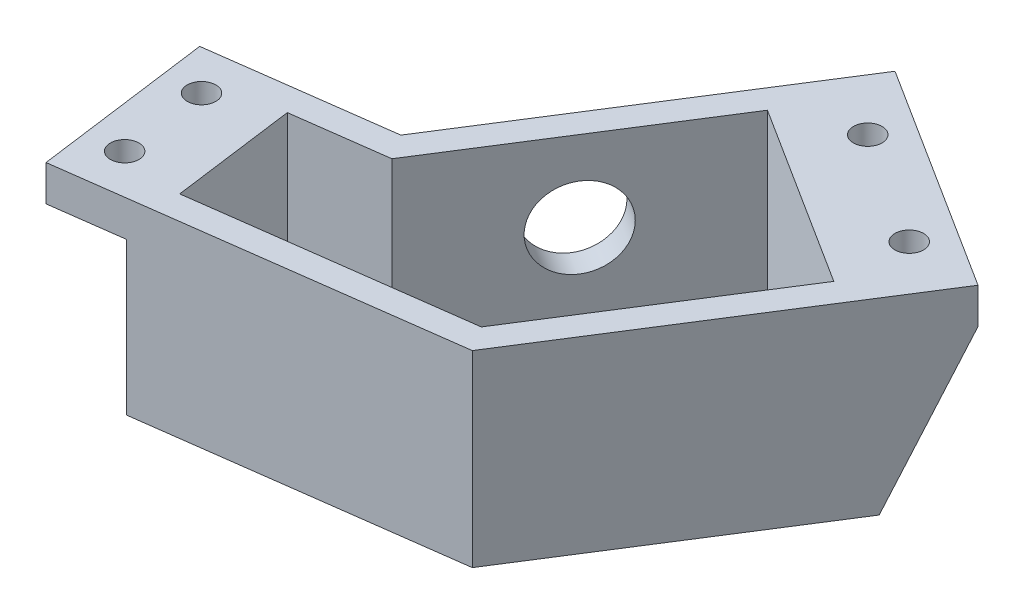
from build123d import *

# Parameters (mm, degrees)
BOSS_EXTRUDE1_DEPTH = 21
CUT_EXTRUDE1_START  = -21
CUT_EXTRUDE1_DEPTH  = 17
CUT_EXTRUDE2_DEPTH  = 18
SKETCH4_R           = 4.5
CUT_EXTRUDE3_DEPTH  = 61.406520735
SKETCH5_R           = 1.6
CUT_EXTRUDE4_DEPTH  = 61.135869745
CUT_EXTRUDE5_DEPTH  = 0.5
SKETCH7_R           = 3
CUT_EXTRUDE6_DEPTH  = 70.022736907
BOSS_EXTRUDE2_DEPTH = 30
SKETCH9_R           = 1.6
CUT_EXTRUDE7_DEPTH  = 62.386666638
CUT_EXTRUDE8_START  = -4
SKETCH10_R          = 3.5
CUT_EXTRUDE8_DEPTH  = 58.386666638
CUT_EXTRUDE9_DEPTH  = 0.5


with BuildPart() as part:
    # Sketch1 → Boss-Extrude1 (new body)
    with BuildSketch(Plane(origin=(0, 0, 0), x_dir=(1, 0, 0), z_dir=(0, 1, 0))):
        Polygon((0, 0), (-19.823417158, -2.651816769), (-17.171600389, -22.475233927), (24.834444629, -16.856004221), (46.756935141, 17.714090893), (21.421674862, 33.78034704), align=None)
    extrude(amount=BOSS_EXTRUDE1_DEPTH)

    # Sketch2 → Cut-Extrude1 (cut)
    with BuildSketch(Plane(origin=(0, 21, 0), x_dir=(1, 0, 0), z_dir=(0, 1, 0)).offset(CUT_EXTRUDE1_START)):
        Polygon((21.421674862, 33.78034704), (17.137339889, 27.024277632), (42.472600169, 10.958021485), (46.756935141, 17.714090893), align=None)
        Polygon((-19.823417158, -2.651816769), (-17.171600389, -22.475233927), (-9.242233526, -21.414507219), (-11.894050295, -1.591090061), align=None)
    extrude(amount=CUT_EXTRUDE1_DEPTH, mode=Mode.SUBTRACT)

    # Sketch3 → Cut-Extrude2 (cut)
    with BuildSketch(Plane(origin=(0, 21, 0), x_dir=(1, 0, 0), z_dir=(0, 1, 0))):
        Polygon((23.050100429, -14.067976017), (38.332448526, 10.031121072), (18.064240303, 22.884125989), (1.7843442, -2.788028204), (-8.522765206, -4.16683012), (-6.666493468, -18.04322213), align=None)
    extrude(amount=-CUT_EXTRUDE2_DEPTH, mode=Mode.SUBTRACT)

    # Sketch4 → Cut-Extrude3 (cut, through all)
    with BuildSketch(Plane(origin=(2.533526028, 0, 1.606625615), x_dir=(0.53554187154216, 0, -0.8445086759916209), z_dir=(0.8445086759916209, 0, 0.53554187154216))):
        with Locations((13.800538513, 12)):
            Circle(SKETCH4_R)
    extrude(amount=-CUT_EXTRUDE3_DEPTH, mode=Mode.SUBTRACT)

    # Sketch5 → Cut-Extrude4 (cut, through all)
    with BuildSketch(Plane(origin=(0, 17, 0), x_dir=(-1, 0, 0), z_dir=(0, -1, 0))):
        with Locations(Location((-38.703206923, 18.08484929, 0), (0, 0, 90))):
            Circle(SKETCH5_R)
        with Locations(Location((-26.035576783, 26.117977363, 0), (0, 0, 90))):
            Circle(SKETCH5_R)
        with Locations(Location((13.86987115, -16.989016284, 0), (0, 0, 90))):
            Circle(SKETCH5_R)
        with Locations(Location((15.195779534, -7.077307705, 0), (0, 0, 90))):
            Circle(SKETCH5_R)
    extrude(amount=-CUT_EXTRUDE4_DEPTH, mode=Mode.SUBTRACT)

    # Sketch6 → Cut-Extrude5 (cut)
    # profile 1 of 3: a face of its own
    with BuildSketch(Plane(origin=(0, 0, 0), x_dir=(-0.535541871542157, 0, 0.8445086759916229), z_dir=(-0.8445086759916228, 0, -0.5355418715421569))):
        with BuildLine():
            add(Edge.make_bspline(
                [(-25.481971154, 7.115384615), (-25.519043916, 7.115596913), (-25.591850035, 7.116013838), (-25.698659344, 7.123238188), (-25.801040056, 7.132760442), (-25.898589468, 7.148267419), (-25.991764145, 7.166509285), (-26.08053643, 7.189325018), (-26.164595001, 7.216809897), (-26.21826549, 7.238674335), (-26.244591346, 7.249399038)],
                knots=[0, 0, 0, 0, 1.141009212, 2.240794809, 3.294380675, 4.305229195, 5.280013876, 6.216333343, 7.125095522, 8, 8, 8, 8], degree=3))
            add(Edge.make_bspline(
                [(-26.244591346, 7.249399038), (-26.282022531, 7.266921517), (-26.356444649, 7.30176038), (-26.46164204, 7.366700849), (-26.561260022, 7.439709664), (-26.653992687, 7.521111837), (-26.738136642, 7.60885611), (-26.810721137, 7.702353369), (-26.873462326, 7.799148703), (-26.905037843, 7.867966696), (-26.920673077, 7.902043269)],
                knots=[0, 0, 0, 0, 1.031298788, 2.050467816, 3.080965632, 4.112446372, 5.127889083, 6.11150152, 7.064873096, 8, 8, 8, 8], degree=3))
            add(Edge.make_bspline(
                [(-26.920673077, 7.902043269), (-26.93016146, 7.925175642), (-26.949339902, 7.971932066), (-26.973275602, 8.044597051), (-26.992722276, 8.120019152), (-27.010105338, 8.197652845), (-27.02209153, 8.278251888), (-27.032141541, 8.361165007), (-27.037408926, 8.446845958), (-27.038106852, 8.504801639), (-27.038461538, 8.534254808)],
                knots=[0, 0, 0, 0, 0.92659354, 1.872881803, 2.832850937, 3.813025581, 4.820167273, 5.851730198, 6.908245912, 8, 8, 8, 8], degree=3))
            add(Edge.make_bspline(
                [(-27.038461538, 8.534254808), (-27.037139566, 8.586992987), (-27.034552446, 8.690202327), (-27.015865991, 8.840962191), (-26.984312193, 8.983626799), (-26.938705253, 9.117713214), (-26.881695607, 9.244377546), (-26.810981567, 9.362635477), (-26.727328774, 9.472662819), (-26.631883246, 9.574244079), (-26.52481561, 9.665734035), (-26.407109844, 9.745381324), (-26.279214048, 9.812405384), (-26.141566535, 9.867022734), (-25.994036794, 9.90970595), (-25.836773836, 9.940110624), (-25.669500043, 9.958298508), (-25.55473409, 9.960439106), (-25.495793269, 9.961538462)],
                knots=[0, 0, 0, 0, 1.064649597, 2.083533894, 3.06182455, 4.009573214, 4.938114978, 5.86134754, 6.785138072, 7.723633163, 8.670337, 9.622734556, 10.587021061, 11.579917593, 12.607721694, 13.68331646, 14.81021135, 16, 16, 16, 16], degree=3))
            add(Edge.make_bspline(
                [(-25.495793269, 9.961538462), (-25.437248653, 9.960459716), (-25.323273224, 9.958359599), (-25.157290956, 9.939899601), (-25.000872201, 9.910453418), (-24.854535562, 9.867519594), (-24.717432428, 9.813692828), (-24.59087976, 9.746358425), (-24.473111052, 9.668326572), (-24.367191854, 9.576980639), (-24.271199977, 9.477105356), (-24.188524506, 9.367218557), (-24.11771475, 9.249821226), (-24.060540329, 9.123847562), (-24.015872655, 8.990118429), (-23.984076387, 8.848197467), (-23.965461841, 8.698011874), (-23.962865328, 8.595204669), (-23.961538462, 8.542668269)],
                knots=[0, 0, 0, 0, 1.188441339, 2.313673251, 3.386638619, 4.416397407, 5.405891428, 6.372077474, 7.321986495, 8.268353052, 9.206290124, 10.129648818, 11.054654577, 11.984788619, 12.932788448, 13.912688147, 14.933344701, 16, 16, 16, 16], degree=3))
            add(Edge.make_bspline(
                [(-23.961538462, 8.542668269), (-23.96287496, 8.489534093), (-23.96549087, 8.385535247), (-23.983956803, 8.233715211), (-24.016077926, 8.090562948), (-24.059731702, 7.955358099), (-24.117158894, 7.828681905), (-24.18699078, 7.710170245), (-24.270268758, 7.600637638), (-24.365109898, 7.499920583), (-24.470720887, 7.408626594), (-24.587740712, 7.330731306), (-24.713182887, 7.263204503), (-24.848945004, 7.209523441), (-24.993630944, 7.166442149), (-25.148073045, 7.13707836), (-25.311846297, 7.11854913), (-25.424226352, 7.116458734), (-25.481971154, 7.115384615)],
                knots=[0, 0, 0, 0, 1.080851458, 2.115536814, 3.105208919, 4.06142606, 5.000707585, 5.928846123, 6.853919921, 7.79375822, 8.738786042, 9.687076824, 10.64785939, 11.631623957, 12.651566366, 13.714523363, 14.825642194, 16, 16, 16, 16], degree=3))
        make_face()
        with BuildLine():
            add(Edge.make_bspline(
                [(-25.501802885, 7.692307692), (-25.460305005, 7.692884104), (-25.379945152, 7.694000313), (-25.263304007, 7.705886948), (-25.15426369, 7.72393079), (-25.052935329, 7.75045007), (-24.959289256, 7.784007824), (-24.873248867, 7.824857285), (-24.795047204, 7.873695174), (-24.725479679, 7.930495525), (-24.663560037, 7.992556719), (-24.608912846, 8.05854265), (-24.563732685, 8.129669452), (-24.526158513, 8.204273746), (-24.497433905, 8.283017239), (-24.47587085, 8.365406556), (-24.464094422, 8.452181912), (-24.462399587, 8.511385625), (-24.461538462, 8.541466346)],
                knots=[0, 0, 0, 0, 1.313714757, 2.543983635, 3.708927593, 4.810629344, 5.856122632, 6.85490097, 7.821198974, 8.76835797, 9.692418868, 10.594039946, 11.475666139, 12.355144307, 13.23425633, 14.12512326, 15.047396847, 16, 16, 16, 16], degree=3))
            add(Edge.make_bspline(
                [(-24.461538462, 8.541466346), (-24.462381853, 8.571551327), (-24.464041785, 8.630763423), (-24.476063951, 8.71742922), (-24.496689599, 8.799992659), (-24.525327172, 8.878385659), (-24.56329596, 8.9521992), (-24.608326757, 9.022439834), (-24.662372551, 9.087937264), (-24.72353675, 9.149659026), (-24.793497027, 9.204972301), (-24.871707942, 9.253381389), (-24.958264163, 9.294213884), (-25.052873821, 9.327774586), (-25.155703597, 9.353641083), (-25.266766587, 9.370948631), (-25.385757227, 9.382931391), (-25.467916667, 9.384043049), (-25.510216346, 9.384615385)],
                knots=[0, 0, 0, 0, 0.949303347, 1.86838219, 2.75460872, 3.63067551, 4.495816858, 5.369073575, 6.258675874, 7.17059545, 8.106564835, 9.066168793, 10.067192861, 11.120964654, 12.229518689, 13.408091079, 14.665559114, 16, 16, 16, 16], degree=3))
            add(Edge.make_bspline(
                [(-25.510216346, 9.384615385), (-25.552108013, 9.383969942), (-25.633235205, 9.382719981), (-25.750718105, 9.371805654), (-25.860039827, 9.353994527), (-25.961257299, 9.328979376), (-26.054356133, 9.296661883), (-26.13918442, 9.256804777), (-26.216042602, 9.209976136), (-26.284279177, 9.155636959), (-26.34365973, 9.095137302), (-26.39620725, 9.030483666), (-26.439866377, 8.960430907), (-26.476636554, 8.885966453), (-26.503907129, 8.806263231), (-26.523800526, 8.722145203), (-26.536050303, 8.633370457), (-26.537645871, 8.572555469), (-26.538461538, 8.541466346)],
                knots=[0, 0, 0, 0, 1.332239421, 2.580008232, 3.749024652, 4.852419255, 5.89224124, 6.878439556, 7.828083302, 8.748549668, 9.645153656, 10.519845698, 11.393144178, 12.26513999, 13.155815239, 14.066102797, 15.011375811, 16, 16, 16, 16], degree=3))
            add(Edge.make_bspline(
                [(-26.538461538, 8.541466346), (-26.537658138, 8.510373467), (-26.536086566, 8.449551131), (-26.523637899, 8.360635575), (-26.504323064, 8.276261332), (-26.475546227, 8.196537779), (-26.43898766, 8.121637931), (-26.394639124, 8.050979228), (-26.342076194, 7.985212144), (-26.281245693, 7.924513221), (-26.212475961, 7.86933815), (-26.13486413, 7.821751531), (-26.049083449, 7.781665005), (-25.955377314, 7.748323554), (-25.853338935, 7.723779715), (-25.743580555, 7.704877595), (-25.625409401, 7.694271803), (-25.543890602, 7.692976467), (-25.501802885, 7.692307692)],
                knots=[0, 0, 0, 0, 0.981853791, 1.920653289, 2.83086505, 3.71158433, 4.591757822, 5.459075689, 6.341611823, 7.24548826, 8.168543921, 9.120390574, 10.113981418, 11.154755163, 12.256733604, 13.425033512, 14.670558662, 16, 16, 16, 16], degree=3))
        make_face(mode=Mode.SUBTRACT)
    # profile 2 of 3: a face of its own
    with BuildSketch(Plane(origin=(0, 0, 0), x_dir=(-0.535541871542157, 0, 0.8445086759916229), z_dir=(-0.8445086759916228, 0, -0.5355418715421569))):
        with BuildLine():
            Line((-27, 10.461538462), (-27, 11.670072115))
            add(Edge.make_bspline(
                [(-27, 11.670072115), (-26.999829839, 11.69911853), (-26.999501238, 11.755210481), (-26.998535392, 11.836555857), (-26.995925878, 11.912071726), (-26.993177143, 11.981811766), (-26.989015594, 12.045739573), (-26.983529546, 12.104024953), (-26.977571556, 12.156724301), (-26.969251475, 12.219066699), (-26.952901236, 12.291037471), (-26.9257717, 12.372788016), (-26.891019068, 12.449903718), (-26.847978488, 12.522166934), (-26.796622607, 12.588989047), (-26.737734627, 12.650454797), (-26.670619287, 12.705664861), (-26.596700626, 12.754505577), (-26.516468682, 12.796189734), (-26.429963025, 12.824477121), (-26.339112286, 12.842837434), (-26.276934736, 12.845032988), (-26.245192308, 12.846153846)],
                knots=[0, 0, 0, 0, 1.096429411, 2.11733074, 3.070547401, 3.948484499, 4.751738927, 5.488345268, 6.158031143, 6.753656584, 7.861679414, 8.937685829, 10.000271379, 11.048064588, 12.105201638, 13.174759257, 14.254240477, 15.378323745, 16.514548679, 17.655117985, 18.802907975, 20, 20, 20, 20], degree=3))
            add(Edge.make_bspline(
                [(-26.245192308, 12.846153846), (-26.210634021, 12.8449602), (-26.142296386, 12.842599811), (-26.042271297, 12.821429805), (-25.946775819, 12.786857951), (-25.857164728, 12.738764435), (-25.774814303, 12.679613112), (-25.702491281, 12.609682354), (-25.64064846, 12.52996076), (-25.609874918, 12.470100717), (-25.594350962, 12.439903846)],
                knots=[0, 0, 0, 0, 1.023035585, 2.023012119, 3.014443124, 4.023521462, 5.026822086, 6.009113309, 6.995681492, 8, 8, 8, 8], degree=3))
            add(Edge.make_bspline(
                [(-25.594350962, 12.439903846), (-25.587423552, 12.460242094), (-25.573726282, 12.500456043), (-25.548574178, 12.558016123), (-25.519405368, 12.611946801), (-25.487139642, 12.662220995), (-25.451541125, 12.70922027), (-25.411429455, 12.751571491), (-25.369086696, 12.791704794), (-25.322387367, 12.826938721), (-25.273565026, 12.858830833), (-25.221855502, 12.885902469), (-25.168502544, 12.909344251), (-25.112966185, 12.928949048), (-25.054873943, 12.942923846), (-24.99495763, 12.954121325), (-24.932801987, 12.959849642), (-24.890834532, 12.9609709), (-24.869591346, 12.961538462)],
                knots=[0, 0, 0, 0, 1.072651974, 2.1209089, 3.132484228, 4.131466326, 5.101889999, 6.071643115, 7.041396231, 8.011819904, 8.988565287, 9.95070344, 10.922775742, 11.897213062, 12.887138018, 13.903598663, 14.938838629, 16, 16, 16, 16], degree=3))
            add(Edge.make_bspline(
                [(-24.869591346, 12.961538462), (-24.835671396, 12.960311701), (-24.767790691, 12.957856703), (-24.666748173, 12.940109913), (-24.567633839, 12.909383527), (-24.471010207, 12.868369976), (-24.379748234, 12.817223182), (-24.296473419, 12.757074763), (-24.223913636, 12.687154304), (-24.160687585, 12.609092815), (-24.107892265, 12.52164272), (-24.066406937, 12.42460252), (-24.035929576, 12.317962396), (-24.025702385, 12.242968499), (-24.020432692, 12.204326923)],
                knots=[0, 0, 0, 0, 0.975156922, 1.951486961, 2.939068488, 3.953317763, 4.964290502, 5.941282984, 6.898653353, 7.853108183, 8.82218994, 9.825850537, 10.879741348, 12, 12, 12, 12], degree=3))
            add(Edge.make_bspline(
                [(-24.020432692, 12.204326923), (-24.019182549, 12.189506964), (-24.016312748, 12.155486609), (-24.012744807, 12.097789978), (-24.01004784, 12.026849109), (-24.006859019, 11.942725601), (-24.004556596, 11.845160485), (-24.002984353, 11.734375498), (-24.000943891, 11.610181612), (-24.000325522, 11.523037731), (-24, 11.477163462)],
                knots=[0, 0, 0, 0, 0.490565993, 1.126131979, 1.906526787, 2.832178623, 3.902933831, 5.125497984, 6.486805064, 8, 8, 8, 8], degree=3))
            Line((-24, 11.477163462), (-24, 10.461538462))
            Line((-24, 10.461538462), (-27, 10.461538462))
        make_face()
        with BuildLine():
            Line((-26.5, 11.038461538), (-25.807692308, 11.038461538))
            Line((-25.807692308, 11.038461538), (-25.807692308, 11.456129808))
            add(Edge.make_bspline(
                [(-25.807692308, 11.456129808), (-25.807627432, 11.485577184), (-25.807503857, 11.541668178), (-25.808331952, 11.621394012), (-25.808718542, 11.692512494), (-25.809853128, 11.754819157), (-25.811725614, 11.808301209), (-25.813595444, 11.852765946), (-25.815011121, 11.888470314), (-25.817032644, 11.909260138), (-25.817908654, 11.918269231)],
                knots=[0, 0, 0, 0, 1.528479216, 2.911428072, 4.138414629, 5.21998762, 6.145918986, 6.915989543, 7.530253335, 8, 8, 8, 8], degree=3))
            add(Edge.make_bspline(
                [(-25.817908654, 11.918269231), (-25.821813578, 11.94425394), (-25.829318601, 11.994194958), (-25.851396789, 12.064017413), (-25.883089948, 12.124910352), (-25.923469926, 12.176260658), (-25.971463519, 12.218177521), (-26.027440739, 12.248220531), (-26.090883983, 12.265997132), (-26.135500314, 12.268125999), (-26.158653846, 12.269230769)],
                knots=[0, 0, 0, 0, 1.162264213, 2.233800515, 3.225686071, 4.185688492, 5.110247391, 6.026987019, 6.97610994, 8, 8, 8, 8], degree=3))
            add(Edge.make_bspline(
                [(-26.158653846, 12.269230769), (-26.180793978, 12.268483905), (-26.223675901, 12.267037349), (-26.284413111, 12.25090452), (-26.338820717, 12.225279845), (-26.386270412, 12.189433333), (-26.425988199, 12.143393663), (-26.457048073, 12.087429902), (-26.478389208, 12.021428282), (-26.485858168, 11.973898604), (-26.489783654, 11.948918269)],
                knots=[0, 0, 0, 0, 1.035049891, 2.004727485, 2.919825608, 3.837662617, 4.769073254, 5.748061413, 6.816440993, 8, 8, 8, 8], degree=3))
            add(Edge.make_bspline(
                [(-26.489783654, 11.948918269), (-26.490662317, 11.939107556), (-26.492739634, 11.915913271), (-26.494090042, 11.875601318), (-26.495990652, 11.824326887), (-26.497845551, 11.76182862), (-26.49897807, 11.688104826), (-26.499359767, 11.603365178), (-26.500191478, 11.507613461), (-26.50006618, 11.440104392), (-26.5, 11.404447115)],
                knots=[0, 0, 0, 0, 0.433943041, 1.02591908, 1.776648879, 2.694999143, 3.780816848, 5.02540149, 6.428861738, 8, 8, 8, 8], degree=3))
            Line((-26.5, 11.404447115), (-26.5, 11.038461538))
        make_face(mode=Mode.SUBTRACT)
        with BuildLine():
            Line((-25.307692308, 11.038461538), (-24.5, 11.038461538))
            Line((-24.5, 11.038461538), (-24.5, 11.627403846))
            add(Edge.make_bspline(
                [(-24.5, 11.627403846), (-24.499863857, 11.654849116), (-24.499605468, 11.706938288), (-24.501336126, 11.781246776), (-24.501906787, 11.847581993), (-24.504753848, 11.906254416), (-24.50690762, 11.956955733), (-24.509592659, 11.999894565), (-24.513862645, 12.034735646), (-24.51717765, 12.05529621), (-24.518629808, 12.064302885)],
                knots=[0, 0, 0, 0, 1.504773752, 2.85595359, 4.075347731, 5.141676974, 6.076328919, 6.858106537, 7.499786952, 8, 8, 8, 8], degree=3))
            add(Edge.make_bspline(
                [(-24.518629808, 12.064302885), (-24.523452405, 12.087178484), (-24.532822335, 12.13162399), (-24.559773701, 12.193170956), (-24.593797601, 12.248964005), (-24.638292973, 12.296380897), (-24.690270747, 12.336528197), (-24.751612293, 12.364803398), (-24.820975488, 12.382065586), (-24.869884469, 12.383740482), (-24.895432692, 12.384615385)],
                knots=[0, 0, 0, 0, 1.031197338, 2.003536075, 2.954663529, 3.907439386, 4.862312829, 5.841045557, 6.872242896, 8, 8, 8, 8], degree=3))
            add(Edge.make_bspline(
                [(-24.895432692, 12.384615385), (-24.917342072, 12.383913278), (-24.959986122, 12.382546708), (-25.021207783, 12.368890135), (-25.07733066, 12.347275825), (-25.127679698, 12.316874591), (-25.172373142, 12.278437721), (-25.210244593, 12.231657862), (-25.241791864, 12.177334022), (-25.262468122, 12.125566298), (-25.276075055, 12.076571196), (-25.283604856, 12.029555558), (-25.291917313, 11.973351478), (-25.297248129, 11.907504569), (-25.302368477, 11.83219625), (-25.30473926, 11.747401334), (-25.307642868, 11.653063648), (-25.307675305, 11.586942231), (-25.307692308, 11.552283654)],
                knots=[0, 0, 0, 0, 0.992106207, 1.931018896, 2.828370935, 3.708502536, 4.584358549, 5.488032304, 6.424305121, 7.422835477, 8.006778734, 8.726588553, 9.579537412, 10.582807491, 11.720527972, 13.002061418, 14.42858352, 16, 16, 16, 16], degree=3))
            Line((-25.307692308, 11.552283654), (-25.307692308, 11.038461538))
        make_face(mode=Mode.SUBTRACT)
    # profile 3 of 3: a face of its own
    with BuildSketch(Plane(origin=(0, 0, 0), x_dir=(-0.535541871542157, 0, 0.8445086759916229), z_dir=(-0.8445086759916228, 0, -0.5355418715421569))):
        with BuildLine():
            Line((-25, 13.307692308), (-25.038461538, 13.884615385))
            add(Edge.make_bspline(
                [(-25.038461538, 13.884615385), (-25.014325164, 13.889211635), (-24.967441791, 13.898139559), (-24.900625678, 13.917974513), (-24.838337454, 13.939811572), (-24.781229878, 13.965892906), (-24.728300518, 13.994496986), (-24.680996633, 14.027653327), (-24.638323004, 14.063906613), (-24.600923427, 14.104032127), (-24.567375533, 14.147390526), (-24.539477399, 14.195160587), (-24.515191817, 14.245962321), (-24.495244421, 14.300227052), (-24.480340314, 14.358458017), (-24.469740566, 14.420163608), (-24.462951817, 14.485427865), (-24.462017292, 14.530030966), (-24.461538462, 14.552884615)],
                knots=[0, 0, 0, 0, 1.204677245, 2.340008924, 3.41562088, 4.44046575, 5.417001248, 6.3630415, 7.269134822, 8.159094629, 9.049542694, 9.952967105, 10.867337362, 11.809438639, 12.784390299, 13.812011701, 14.878922867, 16, 16, 16, 16], degree=3))
            add(Edge.make_bspline(
                [(-24.461538462, 14.552884615), (-24.461803029, 14.576938793), (-24.462317625, 14.623725407), (-24.468621119, 14.691536222), (-24.477793927, 14.754899336), (-24.491826379, 14.813506878), (-24.50906377, 14.867651171), (-24.529965003, 14.917385594), (-24.555430102, 14.962331503), (-24.584826815, 15.002363925), (-24.616681388, 15.037535628), (-24.649420548, 15.068740738), (-24.683400036, 15.095358936), (-24.719540045, 15.116512933), (-24.756444873, 15.133598287), (-24.795168749, 15.144898175), (-24.834834519, 15.152529884), (-24.861942939, 15.153405163), (-24.875600962, 15.153846154)],
                knots=[0, 0, 0, 0, 1.418030258, 2.758141892, 4.012849053, 5.190504034, 6.307525772, 7.360759663, 8.365925826, 9.346494891, 10.283396317, 11.160841652, 12.011476082, 12.821866951, 13.625513811, 14.402856512, 15.195311921, 16, 16, 16, 16], degree=3))
            add(Edge.make_bspline(
                [(-24.875600962, 15.153846154), (-24.892711707, 15.153302782), (-24.926186378, 15.152239756), (-24.974070585, 15.13953899), (-25.018475972, 15.120239824), (-25.059089598, 15.091851304), (-25.095895755, 15.053130474), (-25.129496324, 15.003464578), (-25.160546832, 14.942361306), (-25.177745659, 14.896828922), (-25.186899038, 14.872596154)],
                knots=[0, 0, 0, 0, 0.904653283, 1.769821757, 2.60630992, 3.46039906, 4.376381456, 5.421829955, 6.627873392, 8, 8, 8, 8], degree=3))
            add(Edge.make_bspline(
                [(-25.186899038, 14.872596154), (-25.190381689, 14.862203428), (-25.198175294, 14.838946197), (-25.209319416, 14.799271829), (-25.223235462, 14.751482998), (-25.23905327, 14.694889127), (-25.255230724, 14.629509244), (-25.275159512, 14.556073557), (-25.294990285, 14.473686804), (-25.309629357, 14.416048933), (-25.317307692, 14.385817308)],
                knots=[0, 0, 0, 0, 0.521821638, 1.167752076, 1.961721917, 2.891982557, 3.96540661, 5.168436773, 6.514817513, 8, 8, 8, 8], degree=3))
            add(Edge.make_bspline(
                [(-25.317307692, 14.385817308), (-25.327145249, 14.346449908), (-25.346125207, 14.270496949), (-25.379760539, 14.162119818), (-25.413605954, 14.06255486), (-25.448821325, 13.971806856), (-25.486655952, 13.890540118), (-25.526165732, 13.818455644), (-25.566851751, 13.754929311), (-25.597210812, 13.717892565), (-25.611778846, 13.700120192)],
                knots=[0, 0, 0, 0, 1.293827876, 2.496229314, 3.617486305, 4.647214227, 5.598941135, 6.473853732, 7.267666729, 8, 8, 8, 8], degree=3))
            add(Edge.make_bspline(
                [(-25.611778846, 13.700120192), (-25.632413082, 13.67808203), (-25.672868411, 13.634874176), (-25.739344279, 13.577997742), (-25.809565398, 13.53020605), (-25.883013443, 13.490868255), (-25.960111249, 13.460578897), (-26.040342757, 13.43911019), (-26.123917363, 13.425214862), (-26.180833649, 13.42379694), (-26.209735577, 13.423076923)],
                knots=[0, 0, 0, 0, 1.064429417, 2.086912298, 3.078678339, 4.055528992, 5.020032834, 5.993708893, 6.981211098, 8, 8, 8, 8], degree=3))
            add(Edge.make_bspline(
                [(-26.209735577, 13.423076923), (-26.246925124, 13.424519292), (-26.321090592, 13.427395744), (-26.430054541, 13.452513629), (-26.535233017, 13.492843444), (-26.619021693, 13.538438413), (-26.682339616, 13.582879064), (-26.727701632, 13.619635967), (-26.770148503, 13.660034047), (-26.808654955, 13.704606519), (-26.845473756, 13.751703691), (-26.878169438, 13.803148803), (-26.908966919, 13.857483631), (-26.945475915, 13.936112283), (-26.98352187, 14.042868429), (-27.015592197, 14.181763905), (-27.034870606, 14.332993576), (-27.037235659, 14.437841572), (-27.038461538, 14.4921875)],
                knots=[0, 0, 0, 0, 1.173854899, 2.340966893, 3.512960251, 4.725330002, 5.343426374, 5.955334136, 6.568647945, 7.192068799, 7.814943173, 8.455761621, 9.116040544, 9.787122478, 11.192596942, 12.687979905, 14.283278534, 16, 16, 16, 16], degree=3))
            add(Edge.make_bspline(
                [(-27.038461538, 14.4921875), (-27.037866482, 14.536685992), (-27.03670911, 14.623234607), (-27.02500558, 14.748696879), (-27.00679042, 14.865885448), (-26.980642643, 14.974389085), (-26.946094565, 15.074258347), (-26.904941273, 15.165880355), (-26.856081989, 15.249177252), (-26.799236327, 15.323134983), (-26.73656763, 15.389024231), (-26.668115224, 15.446502063), (-26.594743622, 15.495788228), (-26.516506443, 15.537200812), (-26.433001434, 15.569722005), (-26.344332791, 15.593607537), (-26.25070922, 15.609405635), (-26.186557414, 15.613365477), (-26.153846154, 15.615384615)],
                knots=[0, 0, 0, 0, 1.325124071, 2.577337985, 3.749592149, 4.855247722, 5.896868755, 6.892903601, 7.842551483, 8.766257401, 9.665194363, 10.546067736, 11.423174165, 12.293291263, 13.177512979, 14.086532529, 15.024315359, 16, 16, 16, 16], degree=3))
            Line((-26.153846154, 15.615384615), (-26.115384615, 15.038461538))
            add(Edge.make_bspline(
                [(-26.115384615, 15.038461538), (-26.133475993, 15.035134463), (-26.168734206, 15.028650339), (-26.21922089, 15.014533168), (-26.26595287, 14.998676409), (-26.308920446, 14.979816624), (-26.347619236, 14.957899828), (-26.382273217, 14.932873778), (-26.413286287, 14.905712246), (-26.440609282, 14.875652551), (-26.463671321, 14.841607239), (-26.484214353, 14.804559038), (-26.500964324, 14.763111717), (-26.514763926, 14.717853088), (-26.525353743, 14.668582237), (-26.533309298, 14.615610612), (-26.537170598, 14.558750241), (-26.538021374, 14.519635678), (-26.538461538, 14.499399038)],
                knots=[0, 0, 0, 0, 1.150855866, 2.242898388, 3.27787599, 4.237823789, 5.175651342, 6.056061848, 6.908895975, 7.75236871, 8.590605917, 9.477244771, 10.399349179, 11.382998967, 12.435674925, 13.55107929, 14.733005797, 16, 16, 16, 16], degree=3))
            add(Edge.make_bspline(
                [(-26.538461538, 14.499399038), (-26.538073505, 14.478358156), (-26.537318567, 14.437422181), (-26.532685629, 14.377767553), (-26.524133671, 14.321807036), (-26.513001143, 14.269265793), (-26.497856108, 14.220214005), (-26.479389219, 14.174755188), (-26.457648006, 14.132681364), (-26.44054277, 14.10702658), (-26.432091346, 14.094350962)],
                knots=[0, 0, 0, 0, 1.186678824, 2.308736671, 3.37120409, 4.377216403, 5.334874112, 6.262130804, 7.141346615, 8, 8, 8, 8], degree=3))
            add(Edge.make_bspline(
                [(-26.432091346, 14.094350962), (-26.420546461, 14.079844781), (-26.398187603, 14.051750811), (-26.353790513, 14.021515754), (-26.30364533, 14.00331418), (-26.268184264, 14.001123414), (-26.25, 14)],
                knots=[0, 0, 0, 0, 1.037857257, 2.010007357, 2.979541333, 4, 4, 4, 4], degree=3))
            add(Edge.make_bspline(
                [(-26.25, 14), (-26.233005598, 14.000918748), (-26.19952933, 14.002728535), (-26.151975567, 14.020982572), (-26.107913585, 14.049054794), (-26.083978539, 14.07528368), (-26.071514423, 14.088942308)],
                knots=[0, 0, 0, 0, 0.98538058, 1.941042925, 2.927803204, 4, 4, 4, 4], degree=3))
            add(Edge.make_bspline(
                [(-26.071514423, 14.088942308), (-26.063196815, 14.09976064), (-26.0446985, 14.12382055), (-26.02170651, 14.16826746), (-25.997619627, 14.222086393), (-25.973224928, 14.285982809), (-25.948122552, 14.359725444), (-25.922811589, 14.443697005), (-25.898013645, 14.537851151), (-25.872872115, 14.639341841), (-25.8484856, 14.742527168), (-25.821724378, 14.840970332), (-25.795656834, 14.932514081), (-25.768328055, 15.016726388), (-25.74172485, 15.09404313), (-25.714401211, 15.164088461), (-25.687790818, 15.227342883), (-25.651200916, 15.301106332), (-25.601630364, 15.384698564), (-25.529607844, 15.472361047), (-25.448640241, 15.549600592), (-25.372732432, 15.603960772), (-25.307143261, 15.640882787), (-25.254659976, 15.664939719), (-25.199188363, 15.68532145), (-25.141005065, 15.702293328), (-25.07999726, 15.71445386), (-25.016512561, 15.724548729), (-24.950006362, 15.729700123), (-24.904654547, 15.730409026), (-24.881610577, 15.730769231)],
                knots=[0, 0, 0, 0, 0.516255311, 1.148148894, 1.888861859, 2.751620851, 3.738268431, 4.840557414, 6.07428004, 7.42751106, 8.802854092, 10.091833706, 11.293062756, 12.409377658, 13.44651028, 14.39102378, 15.258213098, 16.045831186, 17.510454751, 18.929597364, 20.331088364, 21.740370042, 22.45410143, 23.180993031, 23.925547029, 24.691954406, 25.475059937, 26.281333581, 27.126718562, 28, 28, 28, 28], degree=3))
            add(Edge.make_bspline(
                [(-24.881610577, 15.730769231), (-24.860358778, 15.730274281), (-24.818154763, 15.72929136), (-24.75551428, 15.722418758), (-24.693982512, 15.711800473), (-24.63349976, 15.696044739), (-24.574294301, 15.675340115), (-24.515575907, 15.651547463), (-24.458247723, 15.622347233), (-24.402335753, 15.588888901), (-24.348010467, 15.552000938), (-24.297825683, 15.510255846), (-24.25036243, 15.465729393), (-24.207162838, 15.416868552), (-24.167490709, 15.364243979), (-24.130582734, 15.308548459), (-24.098245311, 15.248648092), (-24.069292847, 15.18541903), (-24.044145772, 15.118252973), (-24.021739635, 15.047317244), (-24.003408197, 14.971950186), (-23.987693997, 14.892786647), (-23.975744236, 14.809535099), (-23.967400396, 14.722300142), (-23.962695004, 14.631061799), (-23.961928766, 14.568915499), (-23.961538462, 14.537259615)],
                knots=[0, 0, 0, 0, 0.900673708, 1.788650733, 2.668102459, 3.545420189, 4.434208745, 5.325103822, 6.228854033, 7.15789738, 8.085853671, 9.00886332, 9.921780837, 10.841974279, 11.769192201, 12.713551961, 13.671065578, 14.651348434, 15.659047947, 16.709071323, 17.802583073, 18.944913937, 20.128896835, 21.365799559, 22.658199399, 24, 24, 24, 24], degree=3))
            add(Edge.make_bspline(
                [(-23.961538462, 14.537259615), (-23.962286144, 14.491553888), (-23.963741899, 14.402563754), (-23.976726822, 14.273269023), (-23.99670136, 14.152028685), (-24.025366199, 14.038840653), (-24.063324596, 13.934102418), (-24.109014587, 13.837391204), (-24.162702566, 13.748570458), (-24.225645808, 13.668457503), (-24.296284711, 13.596070829), (-24.374316635, 13.531223044), (-24.460105148, 13.474693598), (-24.553404294, 13.425813995), (-24.654255407, 13.384428386), (-24.762505981, 13.35010163), (-24.878615529, 13.324292521), (-24.958838728, 13.313321412), (-25, 13.307692308)],
                knots=[0, 0, 0, 0, 1.218139507, 2.37174651, 3.460374984, 4.491365737, 5.47959152, 6.425515823, 7.338627716, 8.240236466, 9.135242029, 10.030263523, 10.939666966, 11.868877268, 12.833814776, 13.842095051, 14.892812657, 16, 16, 16, 16], degree=3))
        make_face()
    extrude(amount=-CUT_EXTRUDE5_DEPTH, mode=Mode.SUBTRACT)

    # Sketch7 → Cut-Extrude6 (cut, through all)
    with BuildSketch(Plane(origin=(-8.920537721, 0, 1.193317546), x_dir=(-0.13259083844779018, 0, -0.9911708579047873), z_dir=(0.9911708579047873, 0, -0.13259083844779018))):
        with Locations((-10, 10)):
            Circle(SKETCH7_R)
    extrude(amount=-CUT_EXTRUDE6_DEPTH, mode=Mode.SUBTRACT)

    # Sketch8 → Boss-Extrude2 (add)
    with BuildSketch(Plane(origin=(0, 0, 0), x_dir=(-0.535541871542157, 0, 0.8445086759916229), z_dir=(-0.8445086759916228, 0, -0.5355418715421569))):
        Polygon((-32, 0), (-40, 17), (-32, 17), align=None)
    extrude(amount=-BOSS_EXTRUDE2_DEPTH)

    # Sketch9 → Cut-Extrude7 (cut, through all)
    with BuildSketch(Plane(origin=(0, 21, 0), x_dir=(1, 0, 0), z_dir=(0, 1, 0))):
        with Locations(Location((26.035576783, 26.117977363, 0), (0, 0, 90))):
            Circle(SKETCH9_R)
        with Locations(Location((38.703206923, 18.08484929, 0), (0, 0, 90))):
            Circle(SKETCH9_R)
    extrude(amount=-CUT_EXTRUDE7_DEPTH, mode=Mode.SUBTRACT)

    # Sketch10 → Cut-Extrude8 (cut, through all)
    with BuildSketch(Plane(origin=(0, 21, 0), x_dir=(1, 0, 0), z_dir=(0, 1, 0)).offset(CUT_EXTRUDE8_START)):
        with Locations(Location((26.035576783, 26.117977363, 0), (0, 0, 270))):
            Circle(SKETCH10_R)
        with Locations(Location((38.703206923, 18.08484929, 0), (0, 0, 270))):
            Circle(SKETCH10_R)
    extrude(amount=-CUT_EXTRUDE8_DEPTH, mode=Mode.SUBTRACT)

    # Sketch11 → Cut-Extrude9 (cut)
    with BuildSketch(Plane(origin=(0, 0, 0), x_dir=(-0.9911708579047874, 0, 0.13259083844778968), z_dir=(-0.13259083844778968, 0, -0.9911708579047874))):
        with BuildLine():
            Line((7, 7.384615385), (7, 6.807692308))
            Line((7, 6.807692308), (4.864182692, 6.807692308))
            add(Edge.make_bspline(
                [(4.864182692, 6.807692308), (4.890724652, 6.781540045), (4.943448502, 6.729590302), (5.017068504, 6.646672323), (5.08531948, 6.560286637), (5.14887498, 6.47074959), (5.205701071, 6.377163029), (5.258317787, 6.280640166), (5.306050606, 6.180736409), (5.332772116, 6.111563719), (5.346153846, 6.076923077)],
                knots=[0, 0, 0, 0, 1.012533066, 2.01133004, 3.011298658, 4.003738876, 4.993547097, 5.985135672, 6.990986248, 8, 8, 8, 8], degree=3))
            Line((5.346153846, 6.076923077), (4.769230769, 6.076923077))
            add(Edge.make_bspline(
                [(4.769230769, 6.076923077), (4.754824404, 6.115344447), (4.724673003, 6.195757386), (4.660539444, 6.314419841), (4.581135628, 6.438276644), (4.503258873, 6.542323429), (4.434020213, 6.6249323), (4.378363196, 6.68266962), (4.321367523, 6.736166566), (4.261193583, 6.783412296), (4.19905796, 6.825647031), (4.135062164, 6.863068848), (4.069004037, 6.896008649), (4.023002622, 6.913252405), (4, 6.921875)],
                knots=[0, 0, 0, 0, 1.253673617, 2.623841347, 4.114270668, 5.751233548, 6.594491912, 7.409089316, 8.202422231, 8.983165545, 9.746111525, 10.498431446, 11.249153235, 12, 12, 12, 12], degree=3))
            Line((4, 6.921875), (4, 7.384615385))
            Line((4, 7.384615385), (7, 7.384615385))
        make_face()
        Polygon((7, 9.21875), (4, 9.950120192), (4, 10.384615385), (7, 9.653846154), align=None)
        with BuildLine():
            Line((6.423076923, 13.653846154), (7, 13.653846154))
            Line((7, 13.653846154), (7, 11.692307692))
            add(Edge.make_bspline(
                [(7, 11.692307692), (6.950693533, 11.698948985), (6.852108247, 11.712227846), (6.708100301, 11.753281809), (6.56757176, 11.808073057), (6.453220127, 11.867544094), (6.361160071, 11.926681194), (6.285761339, 11.980378758), (6.205498838, 12.044152923), (6.120327269, 12.118232372), (6.028265988, 12.200020801), (5.931473614, 12.292426428), (5.829619977, 12.394541848), (5.760500086, 12.466432563), (5.724759615, 12.503605769)],
                knots=[0, 0, 0, 0, 1.156296512, 2.311944673, 3.473480426, 4.661780099, 5.303089413, 6.018290012, 6.814634951, 7.687206241, 8.644427401, 9.679628817, 10.800183922, 12, 12, 12, 12], degree=3))
            add(Edge.make_bspline(
                [(5.724759615, 12.503605769), (5.696123408, 12.533261523), (5.641608504, 12.589717344), (5.563625133, 12.67019332), (5.491764856, 12.740558046), (5.428835865, 12.80369431), (5.371190062, 12.85581831), (5.321591542, 12.899817844), (5.279185952, 12.935119764), (5.252302381, 12.954256757), (5.240384615, 12.962740385)],
                knots=[0, 0, 0, 0, 1.480693537, 2.818804395, 4.024562821, 5.092995305, 6.019822214, 6.815107875, 7.474725043, 8, 8, 8, 8], degree=3))
            add(Edge.make_bspline(
                [(5.240384615, 12.962740385), (5.211531435, 12.980110237), (5.155876992, 13.01361467), (5.068359375, 13.050355061), (4.980859836, 13.072408012), (4.922393144, 13.075434274), (4.893629808, 13.076923077)],
                knots=[0, 0, 0, 0, 1.0911822, 2.104764037, 3.067617678, 4, 4, 4, 4], degree=3))
            add(Edge.make_bspline(
                [(4.893629808, 13.076923077), (4.863692809, 13.075853029), (4.807054343, 13.073828582), (4.72702184, 13.056515872), (4.657962726, 13.026441484), (4.600218706, 12.984366894), (4.554847465, 12.931657199), (4.522313837, 12.869436924), (4.503648895, 12.797931868), (4.501252471, 12.747507646), (4.5, 12.721153846)],
                knots=[0, 0, 0, 0, 1.192591453, 2.256290013, 3.24310292, 4.174320298, 5.08037108, 5.991265773, 6.950151761, 8, 8, 8, 8], degree=3))
            add(Edge.make_bspline(
                [(4.5, 12.721153846), (4.501188589, 12.694989683), (4.503484685, 12.644446168), (4.52344957, 12.572571367), (4.55816814, 12.509965196), (4.597049443, 12.464868419), (4.635459303, 12.434528995), (4.669317924, 12.414271308), (4.707394357, 12.396290037), (4.749554192, 12.380586419), (4.796295905, 12.368137418), (4.847304731, 12.358125338), (4.902842858, 12.350052998), (4.941479683, 12.347486352), (4.961538462, 12.346153846)],
                knots=[0, 0, 0, 0, 1.402547311, 2.709418595, 3.960352363, 5.217414921, 5.875564753, 6.579860135, 7.330004535, 8.132765722, 8.990780366, 9.922661629, 10.921524464, 12, 12, 12, 12], degree=3))
            Line((4.961538462, 12.346153846), (4.905048077, 11.769230769))
            add(Edge.make_bspline(
                [(4.905048077, 11.769230769), (4.86609843, 11.773869063), (4.790581287, 11.782861972), (4.682113743, 11.805305383), (4.582043495, 11.833724061), (4.490574465, 11.869494179), (4.407062063, 11.911064744), (4.332850503, 11.960898172), (4.266498826, 12.016312876), (4.209250424, 12.07872476), (4.16005289, 12.146518703), (4.11712123, 12.218291818), (4.081064179, 12.294217102), (4.051536103, 12.374306705), (4.027877323, 12.458229244), (4.012249048, 12.546428341), (4.001251836, 12.638344277), (4.000423568, 12.701087072), (4, 12.733173077)],
                knots=[0, 0, 0, 0, 1.270843814, 2.463963104, 3.585903199, 4.638480434, 5.643149705, 6.602948721, 7.529039616, 8.438804481, 9.340049933, 10.239750512, 11.145847424, 12.060026686, 13.003613809, 13.967619991, 14.960662244, 16, 16, 16, 16], degree=3))
            add(Edge.make_bspline(
                [(4, 12.733173077), (4.000670319, 12.768054714), (4.001975849, 12.835991082), (4.012759526, 12.935165116), (4.031556074, 13.028335732), (4.056475371, 13.116300352), (4.089671147, 13.198216188), (4.130006779, 13.274447922), (4.177893794, 13.344698858), (4.232530603, 13.40871509), (4.292409359, 13.466448355), (4.35685645, 13.516356379), (4.424746693, 13.558740404), (4.495764225, 13.594083633), (4.571010372, 13.620362918), (4.649491289, 13.639501249), (4.731560461, 13.652193264), (4.787612323, 13.653289097), (4.816105769, 13.653846154)],
                knots=[0, 0, 0, 0, 1.210639269, 2.35787198, 3.457019106, 4.506730944, 5.526821401, 6.519136656, 7.495041567, 8.471763642, 9.435679124, 10.377315972, 11.295713064, 12.209994366, 13.124910071, 14.05585701, 15.011712857, 16, 16, 16, 16], degree=3))
            add(Edge.make_bspline(
                [(4.816105769, 13.653846154), (4.848807146, 13.653112171), (4.913681659, 13.651656061), (5.009585571, 13.637714889), (5.103277951, 13.616415493), (5.194987775, 13.584936663), (5.286914947, 13.545034802), (5.379265808, 13.493600347), (5.474825495, 13.433881054), (5.536609003, 13.387123202), (5.568509615, 13.362980769)],
                knots=[0, 0, 0, 0, 0.953409949, 1.89141903, 2.821310783, 3.752688675, 4.715703262, 5.740811754, 6.833515735, 8, 8, 8, 8], degree=3))
            add(Edge.make_bspline(
                [(5.568509615, 13.362980769), (5.580002302, 13.35385599), (5.604616973, 13.334312827), (5.642359765, 13.301064772), (5.683586791, 13.262533136), (5.729069727, 13.219262161), (5.777197898, 13.169822522), (5.829983985, 13.11599306), (5.884727807, 13.055405123), (5.942794951, 12.992650699), (5.999310896, 12.929623515), (6.052988481, 12.871692403), (6.100481719, 12.819071812), (6.144412011, 12.774211818), (6.181782477, 12.734475534), (6.214505373, 12.701290011), (6.24180002, 12.674049334), (6.284421906, 12.63635825), (6.342332261, 12.589095393), (6.397077423, 12.555172917), (6.423076923, 12.5390625)],
                knots=[0, 0, 0, 0, 0.665575326, 1.425508082, 2.280684414, 3.225408763, 4.272761881, 5.41021365, 6.644952879, 7.976258596, 9.288605593, 10.48482717, 11.558804241, 12.50352859, 13.332623925, 14.033017456, 14.617760368, 15.081099547, 16.613759652, 18, 18, 18, 18], degree=3))
            Line((6.423076923, 12.5390625), (6.423076923, 13.653846154))
        make_face()
    extrude(amount=-CUT_EXTRUDE9_DEPTH, mode=Mode.SUBTRACT)


solid = part.part
